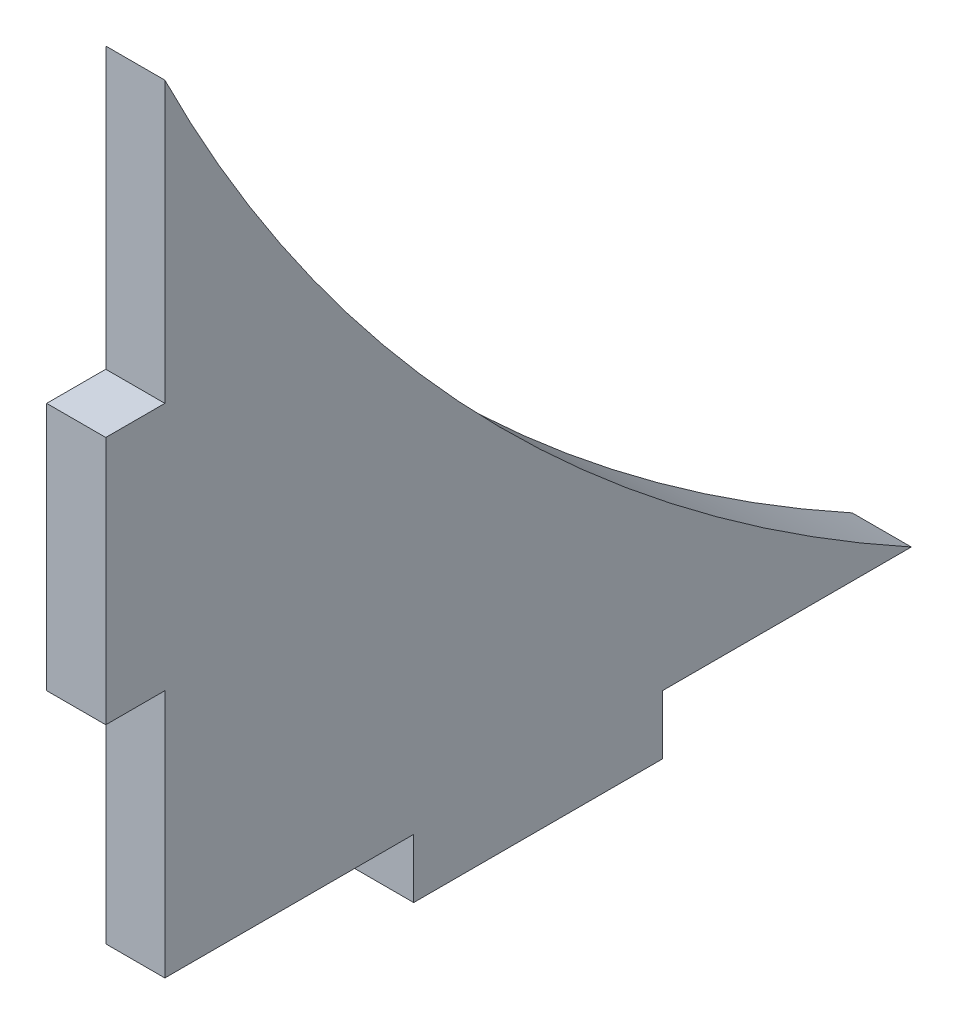
from build123d import *

# Parameters (mm, degrees)
BOSS_EXTRUDE1_DEPTH = 19
SKETCH2_W           = 19
SKETCH2_H           = 80
BOSS_EXTRUDE2_DEPTH = 19
SKETCH3_W           = 19
SKETCH3_H           = 80
BOSS_EXTRUDE3_DEPTH = 19


with BuildPart() as part:
    # Sketch1 → Boss-Extrude1 (new body)
    with BuildSketch(Plane(origin=(0, 0, 0), x_dir=(0, 0, -1), z_dir=(1, 0, 0))):
        with BuildLine():
            Line((-143.772893773, 109.432234432), (-143.772893773, -140.567765568))
            Line((-143.772893773, -140.567765568), (96.227106227, -140.567765568))
            ThreePointArc((96.227106227, -140.567765568), (-42.958076814, -33.985541287), (-143.772893773, 109.432234432))
        make_face()
    extrude(amount=BOSS_EXTRUDE1_DEPTH)

    # Sketch2 → Boss-Extrude2 (add)
    with BuildSketch(Plane.XZ.offset(140.567765568)):
        with Locations((9.5, 23.772893773)):
            Rectangle(SKETCH2_W, SKETCH2_H)
    extrude(amount=BOSS_EXTRUDE2_DEPTH)

    # Sketch3 → Boss-Extrude3 (add)
    with BuildSketch(Plane.XY.offset(143.772893773)):
        with Locations((9.5, -20.567765568)):
            Rectangle(SKETCH3_W, SKETCH3_H)
    extrude(amount=BOSS_EXTRUDE3_DEPTH)


solid = part.part
